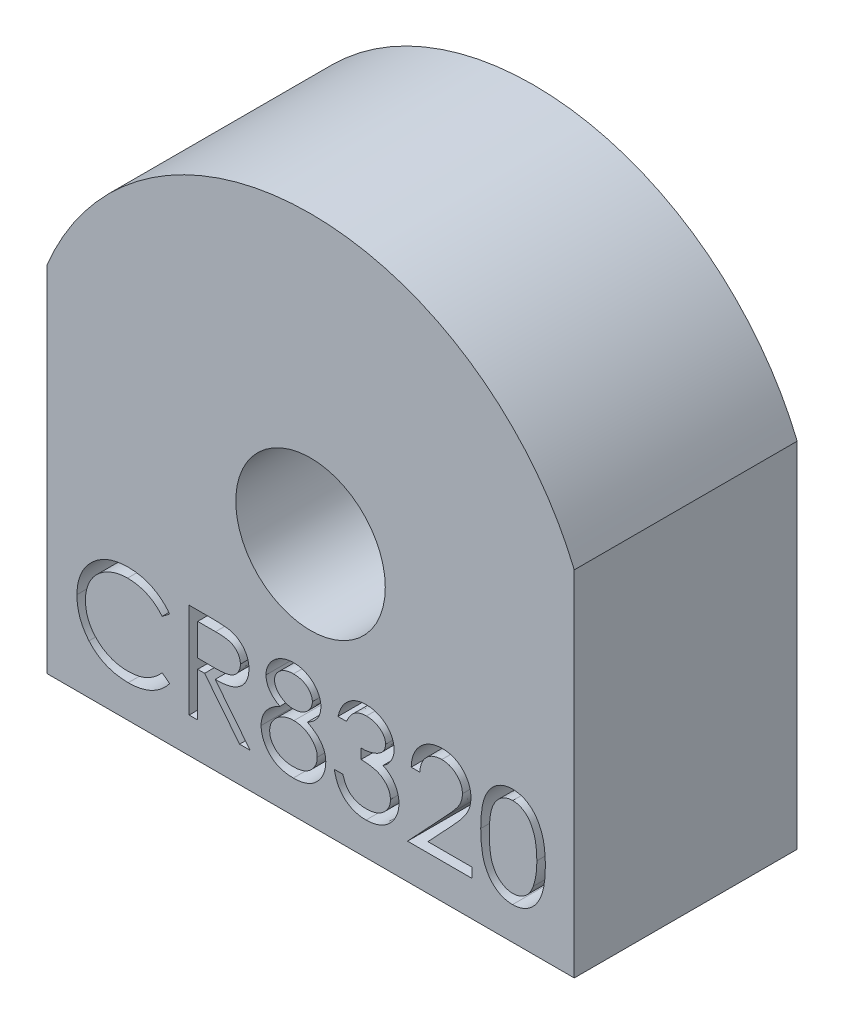
from build123d import *

# Parameters (mm, degrees)
BOSS_EXTRUDE2_DEPTH = 8.2
SKETCH3_R           = 2.75
CUT_EXTRUDE1_DEPTH  = 24.271871433
CUT_EXTRUDE2_DEPTH  = 3


with BuildPart() as part:
    # Sketch1 → Boss-Extrude2 (new body)
    with BuildSketch(Plane.XY):
        with BuildLine():
            Line((9.7, 13), (9.7, 0))
            Line((9.7, 0), (-9.7, 0))
            Line((-9.7, 0), (-9.7, 13))
            ThreePointArc((-9.7, 13), (0, 19.5), (9.7, 13))
        make_face()
    extrude(amount=BOSS_EXTRUDE2_DEPTH)

    # Sketch3 → Cut-Extrude1 (cut, through all)
    with BuildSketch(Plane.XY.offset(8.2)):
        with Locations((0, 8.968179787)):
            Circle(SKETCH3_R)
    extrude(amount=-CUT_EXTRUDE1_DEPTH, mode=Mode.SUBTRACT)

    # Sketch4 → Cut-Extrude2 (cut)
    # profile 1 of 6: a face of its own
    with BuildSketch(Plane.XY.offset(8.2)):
        with BuildLine():
            Line((-5.182729321, 4.150943221), (-5.457569065, 3.940606683))
            add(Edge.make_bspline(
                [(-5.457569065, 3.940606683), (-5.477174953, 3.963972653), (-5.5161224, 4.010389568), (-5.578781602, 4.075569113), (-5.644083245, 4.136634374), (-5.712002366, 4.193876254), (-5.783761486, 4.24529302), (-5.857622285, 4.293564123), (-5.93482033, 4.336831861), (-6.041572064, 4.389294847), (-6.181219913, 4.444041002), (-6.357014752, 4.489944233), (-6.54052585, 4.519165409), (-6.66572345, 4.52233025), (-6.729404, 4.523940016)],
                knots=[0, 0, 0, 0, 0.757959112, 1.505699292, 2.245454638, 2.979532153, 3.711538275, 4.438200793, 5.171680507, 5.909471876, 7.393775596, 8.890124382, 10.418191784, 12, 12, 12, 12], degree=3))
            add(Edge.make_bspline(
                [(-6.729404, 4.523940016), (-6.7644873, 4.523536054), (-6.834328292, 4.522731878), (-6.937976766, 4.512122753), (-7.039689817, 4.497211543), (-7.139401283, 4.475086219), (-7.236984242, 4.4471136), (-7.333076644, 4.413688186), (-7.426287244, 4.372333346), (-7.517905482, 4.326625087), (-7.605684693, 4.274997642), (-7.688739741, 4.21868429), (-7.766767709, 4.158315193), (-7.839830321, 4.093664087), (-7.908002269, 4.025022127), (-7.97078958, 3.951657785), (-8.02797499, 3.873805612), (-8.080692015, 3.792492204), (-8.127904749, 3.707954412), (-8.167434628, 3.619879342), (-8.20243975, 3.529775239), (-8.230138993, 3.436624078), (-8.25206351, 3.341081312), (-8.267191173, 3.242890524), (-8.277679644, 3.142256845), (-8.278479821, 3.074047532), (-8.278883167, 3.039665176)],
                knots=[0, 0, 0, 0, 1.054917814, 2.100044995, 3.131103042, 4.146048494, 5.169673617, 6.183595914, 7.203665975, 8.234915748, 9.262203917, 10.264457458, 11.251630812, 12.227803204, 13.197192746, 14.159520551, 15.12972552, 16.100847026, 17.073214652, 18.039054194, 19.002613845, 19.979014051, 20.95965708, 21.949030935, 22.966165397, 24, 24, 24, 24], degree=3))
            add(Edge.make_bspline(
                [(-8.278883167, 3.039665176), (-8.277621348, 2.987933857), (-8.275143934, 2.886366272), (-8.2530956, 2.737595661), (-8.219590508, 2.595074987), (-8.169374932, 2.459695145), (-8.107455881, 2.329786787), (-8.029215269, 2.207547934), (-7.938598732, 2.091131369), (-7.834324313, 1.983288421), (-7.719918497, 1.884774696), (-7.597170585, 1.798024115), (-7.466386297, 1.725709232), (-7.329009667, 1.665533286), (-7.183983553, 1.619276558), (-7.031568751, 1.586712434), (-6.872096756, 1.565470254), (-6.763127356, 1.563436566), (-6.707669225, 1.562401555)],
                knots=[0, 0, 0, 0, 1.029171465, 2.020641659, 2.987623507, 3.938342917, 4.889210282, 5.84687017, 6.821220943, 7.821438502, 8.827599549, 9.822697543, 10.807740252, 11.797342354, 12.80366471, 13.83203677, 14.896651826, 16, 16, 16, 16], degree=3))
            add(Edge.make_bspline(
                [(-6.707669225, 1.562401555), (-6.646566536, 1.564090334), (-6.526301827, 1.567414257), (-6.349933801, 1.595573506), (-6.181098035, 1.641231424), (-6.019785448, 1.705129346), (-5.866450802, 1.788194634), (-5.720854142, 1.888892512), (-5.582872571, 2.008180844), (-5.499901289, 2.099263973), (-5.457569065, 2.145734888)],
                knots=[0, 0, 0, 0, 1.028121516, 2.023589091, 2.998037872, 3.967518031, 4.937445131, 5.927275754, 6.942489185, 8, 8, 8, 8], degree=3))
            Line((-5.457569065, 2.145734888), (-5.182729321, 1.937501715))
            add(Edge.make_bspline(
                [(-5.182729321, 1.937501715), (-5.204847431, 1.908963263), (-5.248977706, 1.852023057), (-5.320435723, 1.771751347), (-5.395713021, 1.696247311), (-5.475368731, 1.62611969), (-5.558486522, 1.559965225), (-5.646558834, 1.499663393), (-5.738427867, 1.444372509), (-5.833782346, 1.393745585), (-5.932520959, 1.348828338), (-6.034525394, 1.31037457), (-6.139355969, 1.27724968), (-6.247017478, 1.249997744), (-6.357733234, 1.22872666), (-6.471103708, 1.214506985), (-6.587373584, 1.20476507), (-6.665815005, 1.203877155), (-6.705565859, 1.203427196)],
                knots=[0, 0, 0, 0, 0.986787822, 1.968848986, 2.935600012, 3.899624008, 4.868462664, 5.837806735, 6.815139263, 7.798259679, 8.787526145, 9.778297419, 10.776456485, 11.791383307, 12.812564526, 13.85620153, 14.913611965, 16, 16, 16, 16], degree=3))
            add(Edge.make_bspline(
                [(-6.705565859, 1.203427196), (-6.743209527, 1.203689188), (-6.817645217, 1.204207246), (-6.927543968, 1.212599413), (-7.034533549, 1.22404915), (-7.138308175, 1.241289281), (-7.23943415, 1.261633622), (-7.336994734, 1.288904878), (-7.431949945, 1.319454045), (-7.523918285, 1.355359031), (-7.612977985, 1.395875214), (-7.698841797, 1.441666773), (-7.781470229, 1.492348638), (-7.86167565, 1.546803648), (-7.938273234, 1.60678095), (-8.011926759, 1.671447584), (-8.083049235, 1.740585595), (-8.12705192, 1.790440448), (-8.149175635, 1.815506523)],
                knots=[0, 0, 0, 0, 1.114604814, 2.203992996, 3.262667896, 4.300477797, 5.318619304, 6.316056647, 7.298880507, 8.271930387, 9.238335007, 10.195173496, 11.151986948, 12.108099108, 13.064862484, 14.031167946, 15.010108607, 16, 16, 16, 16], degree=3))
            add(Edge.make_bspline(
                [(-8.149175635, 1.815506523), (-8.184611279, 1.859047712), (-8.255054755, 1.945604422), (-8.345180439, 2.085890403), (-8.422327994, 2.232358612), (-8.484703915, 2.385778541), (-8.533466648, 2.545805928), (-8.567247843, 2.712521442), (-8.589199448, 2.885769385), (-8.591709736, 3.003606173), (-8.592985731, 3.063503317)],
                knots=[0, 0, 0, 0, 0.994628077, 1.977248131, 2.950237994, 3.925870899, 4.908910175, 5.911660606, 6.938484602, 8, 8, 8, 8], degree=3))
            add(Edge.make_bspline(
                [(-8.592985731, 3.063503317), (-8.591430538, 3.126458771), (-8.588370791, 3.250319696), (-8.562374996, 3.432093649), (-8.5205562, 3.606245048), (-8.461159311, 3.772448792), (-8.38585396, 3.931579073), (-8.292827346, 4.082420277), (-8.183160204, 4.225937077), (-8.057712636, 4.359951828), (-7.920145301, 4.482491181), (-7.772826487, 4.590297385), (-7.61604454, 4.680014901), (-7.451526688, 4.755011063), (-7.278041007, 4.812655526), (-7.095957638, 4.853008713), (-6.905618723, 4.878125829), (-6.775756297, 4.881301037), (-6.70977259, 4.882914375)],
                knots=[0, 0, 0, 0, 1.032925535, 2.032216505, 3.007276963, 3.968222605, 4.92396291, 5.891752235, 6.871517503, 7.883894988, 8.900124299, 9.891468569, 10.874487609, 11.85992873, 12.854644235, 13.869047385, 14.917252991, 16, 16, 16, 16], degree=3))
            add(Edge.make_bspline(
                [(-6.70977259, 4.882914375), (-6.669558118, 4.882432237), (-6.589957621, 4.881477893), (-6.472204969, 4.872171751), (-6.357562642, 4.856658145), (-6.24595166, 4.835542075), (-6.136829043, 4.809334753), (-6.031028803, 4.775194455), (-5.927930116, 4.736157924), (-5.828183207, 4.691199458), (-5.732266657, 4.640732716), (-5.640210339, 4.585317093), (-5.55274548, 4.525021287), (-5.469256632, 4.460358112), (-5.391140421, 4.389959553), (-5.316178942, 4.315761957), (-5.246917864, 4.235628132), (-5.204164669, 4.179223199), (-5.182729321, 4.150943221)],
                knots=[0, 0, 0, 0, 1.096760587, 2.17092713, 3.219439832, 4.250915756, 5.268269357, 6.278326846, 7.281116186, 8.274029601, 9.260640565, 10.235837813, 11.203064059, 12.156899882, 13.114053108, 14.069676657, 15.032185724, 16, 16, 16, 16], degree=3))
        make_face()
    # profile 2 of 6: a face of its own
    with BuildSketch(Plane.XY.offset(8.2)):
        with BuildLine():
            Line((-4.464780603, 4.793170785), (-3.76435993, 4.793170785))
            add(Edge.make_bspline(
                [(-3.76435993, 4.793170785), (-3.717618801, 4.793015199), (-3.627870657, 4.792716457), (-3.499297387, 4.791050694), (-3.38247029, 4.786276338), (-3.27745045, 4.782167755), (-3.184239795, 4.774675814), (-3.102552505, 4.767515167), (-3.032764807, 4.758141506), (-2.990518956, 4.749436083), (-2.97139118, 4.745494503)],
                knots=[0, 0, 0, 0, 1.410062039, 2.707475311, 3.878576406, 4.937260626, 5.877586885, 6.699081471, 7.410979367, 8, 8, 8, 8], degree=3))
            add(Edge.make_bspline(
                [(-2.97139118, 4.745494503), (-2.945784556, 4.739167738), (-2.895117566, 4.726649174), (-2.8221675, 4.700189574), (-2.752653176, 4.669569949), (-2.686863352, 4.633606229), (-2.625127561, 4.592031449), (-2.56680925, 4.545563326), (-2.511643787, 4.494456121), (-2.461862157, 4.437421279), (-2.414923105, 4.37758477), (-2.375334478, 4.312881013), (-2.341207999, 4.245219485), (-2.314037482, 4.173912067), (-2.292159508, 4.099650296), (-2.276733269, 4.021761499), (-2.267482081, 3.940600524), (-2.266540226, 3.885242615), (-2.266062654, 3.857173189)],
                knots=[0, 0, 0, 0, 1.027469482, 2.033020251, 3.019912614, 3.986113645, 4.951240523, 5.91722682, 6.890402269, 7.87763091, 8.8651537, 9.85103654, 10.82876324, 11.815024772, 12.821070561, 13.842952187, 14.906261191, 16, 16, 16, 16], degree=3))
            add(Edge.make_bspline(
                [(-2.266062654, 3.857173189), (-2.267531652, 3.810538085), (-2.270398048, 3.719540917), (-2.297123152, 3.587480035), (-2.340899672, 3.464290721), (-2.401222961, 3.350128083), (-2.478042436, 3.247217437), (-2.570367227, 3.156826982), (-2.678248839, 3.08118707), (-2.778678155, 3.028734265), (-2.867392355, 2.995141356), (-2.940425667, 2.971504997), (-3.020092645, 2.953243032), (-3.105629979, 2.9368829), (-3.197393635, 2.924531206), (-3.295163674, 2.915484611), (-3.399009826, 2.909830563), (-3.470348895, 2.908988558), (-3.507048231, 2.908555401)],
                knots=[0, 0, 0, 0, 1.260483769, 2.459530307, 3.627416485, 4.787058657, 5.939039949, 7.08810263, 8.267026773, 9.491475466, 10.141966685, 10.831826277, 11.566392101, 12.351337768, 13.187381173, 14.07005841, 15.007169909, 16, 16, 16, 16], degree=3))
            Line((-3.507048231, 2.908555401), (-2.221190859, 1.293170785))
            Line((-2.221190859, 1.293170785), (-2.609612334, 1.293170785))
            Line((-2.609612334, 1.293170785), (-3.895469706, 2.908555401))
            Line((-3.895469706, 2.908555401), (-4.150678039, 2.908555401))
            Line((-4.150678039, 2.908555401), (-4.150678039, 1.293170785))
            Line((-4.150678039, 1.293170785), (-4.464780603, 1.293170785))
            Line((-4.464780603, 1.293170785), (-4.464780603, 4.793170785))
        make_face()
        with BuildLine():
            Line((-4.150678039, 4.434196426), (-4.150678039, 3.26752976))
            Line((-4.150678039, 3.26752976), (-3.509852718, 3.262621907))
            add(Edge.make_bspline(
                [(-3.509852718, 3.262621907), (-3.47993268, 3.262608671), (-3.421939122, 3.262583014), (-3.338038458, 3.26657679), (-3.259918346, 3.271120109), (-3.187877594, 3.278069454), (-3.121884018, 3.287025526), (-3.061970605, 3.29822851), (-3.008039553, 3.311280573), (-2.945141015, 3.331482199), (-2.874904484, 3.363488217), (-2.798573024, 3.410053716), (-2.733570686, 3.468622835), (-2.678652824, 3.535596291), (-2.634523392, 3.60923254), (-2.603411338, 3.688648909), (-2.583668895, 3.771840507), (-2.58134035, 3.829018615), (-2.580165218, 3.857874311)],
                knots=[0, 0, 0, 0, 1.146690395, 2.22261258, 3.21895312, 4.145990853, 4.996080663, 5.770904154, 6.481378293, 7.121626537, 8.300444488, 9.431385265, 10.535395872, 11.636531494, 12.74115979, 13.810798291, 14.895190096, 16, 16, 16, 16], degree=3))
            add(Edge.make_bspline(
                [(-2.580165218, 3.857874311), (-2.58136734, 3.886020885), (-2.583749505, 3.941797123), (-2.603198273, 4.023453034), (-2.636087655, 4.100519984), (-2.680409893, 4.172684469), (-2.734409048, 4.238190205), (-2.79772686, 4.294237358), (-2.868632055, 4.340486822), (-2.934903254, 4.370041203), (-2.994137466, 4.388161056), (-3.045567126, 4.40091222), (-3.103678604, 4.411156689), (-3.168754063, 4.41936475), (-3.240515693, 4.426419694), (-3.319326345, 4.431171473), (-3.404663125, 4.433985337), (-3.463810056, 4.434124426), (-3.494428039, 4.434196426)],
                knots=[0, 0, 0, 0, 1.101028733, 2.181837193, 3.264309656, 4.369019818, 5.486613113, 6.575447106, 7.666700264, 8.788928104, 9.402425223, 10.0903467, 10.862060571, 11.710948788, 12.657782767, 13.684531032, 14.801375019, 16, 16, 16, 16], degree=3))
            Line((-3.494428039, 4.434196426), (-4.150678039, 4.434196426))
        make_face(mode=Mode.SUBTRACT)
    # profile 3 of 6: a face of its own
    with BuildSketch(Plane.XY.offset(8.2)):
        with BuildLine():
            add(Edge.make_bspline(
                [(-0.115722109, 3.242990497), (-0.087073562, 3.228052541), (-0.031199328, 3.198918538), (0.048377881, 3.15200771), (0.121102882, 3.102566746), (0.188993444, 3.052930886), (0.250856794, 3.001199235), (0.306001207, 2.947166079), (0.355788827, 2.892180133), (0.399215611, 2.835310293), (0.437412448, 2.776707644), (0.470424583, 2.716218371), (0.498641786, 2.653975037), (0.521004725, 2.589298207), (0.539426516, 2.523137946), (0.552102121, 2.454639964), (0.558919039, 2.384255623), (0.560207853, 2.336687321), (0.560860423, 2.312601875)],
                knots=[0, 0, 0, 0, 1.272397273, 2.481599622, 3.635517121, 4.734568067, 5.792894095, 6.808321871, 7.773003508, 8.711915296, 9.623354172, 10.525449501, 11.423591555, 12.311487226, 13.218079475, 14.126165749, 15.051214107, 16, 16, 16, 16], degree=3))
            add(Edge.make_bspline(
                [(0.560860423, 2.312601875), (0.560089002, 2.278904143), (0.558562071, 2.212203686), (0.545262087, 2.113757574), (0.525349109, 2.018145792), (0.496269597, 1.925389302), (0.458556206, 1.835999928), (0.41207937, 1.749901155), (0.359468165, 1.665681846), (0.317215925, 1.613862444), (0.295836384, 1.587641939)],
                knots=[0, 0, 0, 0, 1.025265484, 2.029385089, 3.018602448, 3.995076438, 4.983346944, 5.966715145, 6.97116228, 8, 8, 8, 8], degree=3))
            add(Edge.make_bspline(
                [(0.295836384, 1.587641939), (0.26799991, 1.557048165), (0.212670944, 1.496238672), (0.117888017, 1.417287862), (0.013866133, 1.350938468), (-0.0989922, 1.296866574), (-0.220385301, 1.254780715), (-0.350287306, 1.224538197), (-0.488951459, 1.207215768), (-0.58425693, 1.204711778), (-0.633149994, 1.203427196)],
                knots=[0, 0, 0, 0, 0.954267603, 1.896743057, 2.838368354, 3.796610408, 4.779680527, 5.799409237, 6.871065594, 8, 8, 8, 8], degree=3))
            add(Edge.make_bspline(
                [(-0.633149994, 1.203427196), (-0.680163383, 1.204579674), (-0.771646662, 1.206822279), (-0.904804539, 1.22201671), (-1.028927609, 1.248644577), (-1.144737577, 1.285089186), (-1.251536271, 1.332499415), (-1.349019372, 1.391507823), (-1.438593344, 1.459739265), (-1.517539818, 1.539153344), (-1.587628262, 1.624211216), (-1.649196315, 1.711962826), (-1.700370393, 1.802416183), (-1.743697488, 1.89422255), (-1.776865511, 1.988668705), (-1.799837722, 2.085268718), (-1.814427036, 2.183853861), (-1.81636817, 2.250385514), (-1.817344706, 2.283855882)],
                knots=[0, 0, 0, 0, 1.256902934, 2.445805442, 3.576955095, 4.645999104, 5.686449165, 6.692658513, 7.68621702, 8.689161843, 9.678783111, 10.630372946, 11.551080876, 12.453998257, 13.34127905, 14.221779781, 15.105423033, 16, 16, 16, 16], degree=3))
            add(Edge.make_bspline(
                [(-1.817344706, 2.283855882), (-1.816766825, 2.308415074), (-1.815624728, 2.356952705), (-1.807719879, 2.428662034), (-1.795011418, 2.498458169), (-1.777751961, 2.566598912), (-1.754360935, 2.632588185), (-1.726118802, 2.696738658), (-1.693186849, 2.759122757), (-1.655105684, 2.820081638), (-1.61080366, 2.878761151), (-1.56064001, 2.936157145), (-1.503612142, 2.991379012), (-1.440354483, 3.045101437), (-1.371589943, 3.098277411), (-1.295532413, 3.14803314), (-1.214198145, 3.197891105), (-1.15639274, 3.22769943), (-1.126739738, 3.242990497)],
                knots=[0, 0, 0, 0, 0.941657376, 1.861047343, 2.762797495, 3.66048619, 4.553285746, 5.444104102, 6.34607688, 7.256116206, 8.197091036, 9.162375105, 10.176350973, 11.237807142, 12.343728897, 13.50695164, 14.721116704, 16, 16, 16, 16], degree=3))
            add(Edge.make_bspline(
                [(-1.126739738, 3.242990497), (-1.167331112, 3.265125266), (-1.245927375, 3.307984373), (-1.349996816, 3.386731179), (-1.43938744, 3.472018994), (-1.511642157, 3.565648789), (-1.568514385, 3.664695663), (-1.60753299, 3.768539916), (-1.633929474, 3.875256029), (-1.636544301, 3.948162226), (-1.637857526, 3.984777356)],
                knots=[0, 0, 0, 0, 1.166880483, 2.259407225, 3.286803203, 4.280235371, 5.237608625, 6.161067461, 7.076446754, 8, 8, 8, 8], degree=3))
            add(Edge.make_bspline(
                [(-1.637857526, 3.984777356), (-1.636222102, 4.022074914), (-1.632934614, 4.097049511), (-1.606351294, 4.208655635), (-1.563031227, 4.3182722), (-1.50411023, 4.425367912), (-1.430723014, 4.526318127), (-1.342676468, 4.616859073), (-1.242073171, 4.696170556), (-1.129415304, 4.762746729), (-1.008179069, 4.816930387), (-0.880263345, 4.85430881), (-0.747896852, 4.878744927), (-0.657799132, 4.881511582), (-0.61211634, 4.882914375)],
                knots=[0, 0, 0, 0, 0.888701115, 1.786444228, 2.72001202, 3.692817113, 4.693886446, 5.687152267, 6.695133018, 7.739871481, 8.800368666, 9.853104506, 10.91144658, 12, 12, 12, 12], degree=3))
            add(Edge.make_bspline(
                [(-0.61211634, 4.882914375), (-0.567612525, 4.881468032), (-0.479856072, 4.878616008), (-0.350861445, 4.85482913), (-0.227436567, 4.81509961), (-0.110007068, 4.761202387), (-0.000675201, 4.694815446), (0.095927109, 4.614414572), (0.181259691, 4.524273021), (0.251844085, 4.423353418), (0.310006974, 4.316669225), (0.350507875, 4.205046704), (0.376459849, 4.090897645), (0.379733213, 4.013659641), (0.381373243, 3.974961651)],
                knots=[0, 0, 0, 0, 1.072916533, 2.115669174, 3.151510826, 4.193348718, 5.225979165, 6.227137561, 7.216255879, 8.211077061, 9.189680878, 10.138522389, 11.067357538, 12, 12, 12, 12], degree=3))
            add(Edge.make_bspline(
                [(0.381373243, 3.974961651), (0.379938682, 3.936984987), (0.377121287, 3.862400978), (0.353421347, 3.753674457), (0.313508034, 3.651852418), (0.259013871, 3.555779466), (0.187988383, 3.467197968), (0.10137965, 3.384981499), (-0.000121828, 3.30845467), (-0.076382714, 3.265268306), (-0.115722109, 3.242990497)],
                knots=[0, 0, 0, 0, 0.975232327, 1.915300861, 2.843280834, 3.77672583, 4.742871857, 5.749627742, 6.839139064, 8, 8, 8, 8], degree=3))
        make_face()
        with BuildLine():
            add(Edge.make_bspline(
                [(-0.629644385, 4.523940016), (-0.654195191, 4.523288576), (-0.702227302, 4.522014073), (-0.772655973, 4.515355436), (-0.839628341, 4.502402219), (-0.903844141, 4.485163508), (-0.964422953, 4.46187552), (-1.022187508, 4.43448051), (-1.076154698, 4.401174445), (-1.126976001, 4.363813247), (-1.172726775, 4.322720341), (-1.213331327, 4.279906622), (-1.247059441, 4.23453123), (-1.275700551, 4.18772287), (-1.296482068, 4.138092294), (-1.312046372, 4.087161118), (-1.322567763, 4.034285734), (-1.323356154, 3.998149223), (-1.323754962, 3.979869503)],
                knots=[0, 0, 0, 0, 1.203892937, 2.355340988, 3.463153438, 4.544400666, 5.610487187, 6.640501085, 7.674077295, 8.714426146, 9.728707835, 10.68524104, 11.601827946, 12.495867327, 13.368432065, 14.231010473, 15.105153427, 16, 16, 16, 16], degree=3))
            add(Edge.make_bspline(
                [(-1.323754962, 3.979869503), (-1.323067595, 3.961588994), (-1.321709259, 3.925464081), (-1.311204131, 3.872118215), (-1.295547277, 3.819696578), (-1.270896615, 3.769445667), (-1.241330257, 3.719622308), (-1.204838781, 3.671471722), (-1.161349753, 3.624826337), (-1.112322313, 3.580082896), (-1.058910775, 3.538184133), (-1.002326731, 3.501810951), (-0.94328034, 3.471376841), (-0.882378271, 3.446047436), (-0.818999824, 3.426357499), (-0.75353335, 3.412388852), (-0.685967848, 3.403706855), (-0.640187267, 3.402669834), (-0.617024193, 3.402145144)],
                knots=[0, 0, 0, 0, 0.873023192, 1.725219244, 2.590779336, 3.480155217, 4.391973325, 5.357036234, 6.360879153, 7.436073238, 8.526419356, 9.601555421, 10.645666583, 11.697338044, 12.750135903, 13.812665442, 14.89329948, 16, 16, 16, 16], degree=3))
            add(Edge.make_bspline(
                [(-0.617024193, 3.402145144), (-0.587274089, 3.403018012), (-0.528067721, 3.404755125), (-0.44078839, 3.420906298), (-0.355925745, 3.446312216), (-0.274386841, 3.481072182), (-0.198282256, 3.524700042), (-0.130442187, 3.57693306), (-0.071445295, 3.636565157), (-0.021904684, 3.702667993), (0.016505162, 3.773019581), (0.04640697, 3.843619874), (0.063868185, 3.915222105), (0.066145752, 3.963189069), (0.067270679, 3.986880721)],
                knots=[0, 0, 0, 0, 1.076279235, 2.141928126, 3.20205304, 4.278698113, 5.344010996, 6.36967002, 7.368914609, 8.37248503, 9.349703398, 10.264243087, 11.142681841, 12, 12, 12, 12], degree=3))
            add(Edge.make_bspline(
                [(0.067270679, 3.986880721), (0.066738781, 4.003508757), (0.065683041, 4.036513025), (0.056982985, 4.085251391), (0.042607152, 4.132880974), (0.023144072, 4.179795245), (-0.002465723, 4.225335977), (-0.03282991, 4.270219065), (-0.069714412, 4.313434829), (-0.111110845, 4.355990377), (-0.158056254, 4.395374401), (-0.210460166, 4.430009111), (-0.268053916, 4.459421468), (-0.330838866, 4.483310222), (-0.39858379, 4.501252572), (-0.470976665, 4.51468892), (-0.548621112, 4.522262031), (-0.602050863, 4.523368557), (-0.629644385, 4.523940016)],
                knots=[0, 0, 0, 0, 0.814439003, 1.616544685, 2.417341072, 3.248991801, 4.09997495, 4.973547432, 5.9003056, 6.880240646, 7.880314356, 8.896779544, 9.951930927, 11.043077905, 12.18215768, 13.381699519, 14.647792085, 16, 16, 16, 16], degree=3))
        make_face(mode=Mode.SUBTRACT)
        with BuildLine():
            add(Edge.make_bspline(
                [(-0.609311853, 3.043170785), (-0.640437639, 3.042617144), (-0.701498835, 3.041531035), (-0.790955763, 3.029441534), (-0.876808929, 3.012612141), (-0.958768865, 2.987081303), (-1.036800962, 2.953884813), (-1.111327645, 2.913950273), (-1.181778774, 2.866744829), (-1.2471815, 2.812868214), (-1.30690483, 2.75480876), (-1.35930313, 2.693346625), (-1.40380065, 2.629624092), (-1.439633901, 2.562831863), (-1.469045633, 2.494384252), (-1.488359511, 2.422576657), (-1.500741222, 2.348789543), (-1.502403854, 2.298629445), (-1.503242142, 2.273339055)],
                knots=[0, 0, 0, 0, 1.140299081, 2.23698856, 3.303958914, 4.344563908, 5.37730929, 6.408454204, 7.439741482, 8.480804886, 9.510774543, 10.48932336, 11.43758569, 12.353841022, 13.263987381, 14.161954604, 15.073269652, 16, 16, 16, 16], degree=3))
            add(Edge.make_bspline(
                [(-1.503242142, 2.273339055), (-1.501878883, 2.241908149), (-1.499174209, 2.179549965), (-1.47771757, 2.087386894), (-1.443282035, 1.998165839), (-1.395256819, 1.912613886), (-1.335789246, 1.83266378), (-1.262662778, 1.762975004), (-1.180421941, 1.701053526), (-1.086284087, 1.650972992), (-0.983455621, 1.610978137), (-0.871963892, 1.583422175), (-0.753408973, 1.565180725), (-0.671549381, 1.563342544), (-0.629644385, 1.562401555)],
                knots=[0, 0, 0, 0, 0.898778495, 1.783155532, 2.693654817, 3.627872908, 4.583023416, 5.533784346, 6.509005473, 7.520592997, 8.575161974, 9.658835044, 10.801527049, 12, 12, 12, 12], degree=3))
            add(Edge.make_bspline(
                [(-0.629644385, 1.562401555), (-0.596894017, 1.563030363), (-0.533085798, 1.564255484), (-0.439999849, 1.575069778), (-0.352155301, 1.592219402), (-0.269722502, 1.617162948), (-0.191778663, 1.647612925), (-0.119645308, 1.686785006), (-0.051466781, 1.731337329), (0.009397341, 1.784195486), (0.06483055, 1.840674981), (0.113163843, 1.900465024), (0.155121394, 1.961940656), (0.18805235, 2.026491141), (0.214378603, 2.092878055), (0.233302158, 2.161713567), (0.244978373, 2.2332088), (0.246159269, 2.281707871), (0.246757858, 2.306291779)],
                knots=[0, 0, 0, 0, 1.224942928, 2.386581632, 3.501229538, 4.569074225, 5.605009692, 6.626002462, 7.634866581, 8.645888296, 9.63523824, 10.59253846, 11.518950513, 12.414518923, 13.29783783, 14.186679152, 15.080837789, 16, 16, 16, 16], degree=3))
            add(Edge.make_bspline(
                [(0.246757858, 2.306291779), (0.24585201, 2.33016912), (0.244065835, 2.377251064), (0.232729144, 2.447017591), (0.212813266, 2.514420405), (0.18548587, 2.580270411), (0.149104907, 2.643233362), (0.106260037, 2.704949533), (0.054565918, 2.763705978), (-0.003846678, 2.819959074), (-0.067505639, 2.87197481), (-0.135172784, 2.917989249), (-0.206327246, 2.956741365), (-0.280818456, 2.988257861), (-0.358481012, 3.01304533), (-0.439257791, 3.030361326), (-0.523243366, 3.041260928), (-0.580298236, 3.042526974), (-0.609311853, 3.043170785)],
                knots=[0, 0, 0, 0, 0.917430815, 1.809013306, 2.70690318, 3.612392954, 4.541220862, 5.495268465, 6.494511384, 7.542276156, 8.608045339, 9.649016899, 10.681629292, 11.715607085, 12.752076957, 13.808767841, 14.885711793, 16, 16, 16, 16], degree=3))
        make_face(mode=Mode.SUBTRACT)
    # profile 4 of 6: a face of its own
    with BuildSketch(Plane.XY.offset(8.2)):
        with BuildLine():
            Line((1.323680935, 3.985478478), (1.009578371, 3.985478478))
            add(Edge.make_bspline(
                [(1.009578371, 3.985478478), (1.018087922, 4.020710962), (1.034723398, 4.089587586), (1.069420971, 4.187994847), (1.107220226, 4.281118368), (1.152609331, 4.367214442), (1.202118085, 4.448013345), (1.258840807, 4.521682469), (1.320160529, 4.590095435), (1.387985478, 4.650808672), (1.45911414, 4.705786401), (1.53454876, 4.752661459), (1.612771653, 4.792985612), (1.694324786, 4.826205844), (1.779450958, 4.851231367), (1.867380581, 4.869388173), (1.958344082, 4.881179287), (2.020091672, 4.88233005), (2.051445358, 4.882914375)],
                knots=[0, 0, 0, 0, 1.162005537, 2.271625781, 3.343758855, 4.383309926, 5.390229558, 6.379919256, 7.361854164, 8.333198761, 9.295911338, 10.242430842, 11.177959212, 12.116337295, 13.062827104, 14.020064771, 14.994644689, 16, 16, 16, 16], degree=3))
            add(Edge.make_bspline(
                [(2.051445358, 4.882914375), (2.097128101, 4.881535145), (2.187497112, 4.878806769), (2.320260158, 4.853892333), (2.448286978, 4.814467201), (2.570176225, 4.759993473), (2.683394658, 4.69280616), (2.784130845, 4.612841423), (2.871019356, 4.521642122), (2.943913733, 4.420909558), (3.000988732, 4.313254048), (3.043075106, 4.202453891), (3.068696787, 4.08877192), (3.072017344, 4.012014641), (3.073680935, 3.973559407)],
                knots=[0, 0, 0, 0, 1.083050992, 2.142477498, 3.193116406, 4.255571735, 5.30263384, 6.308962982, 7.297363603, 8.282367274, 9.249857812, 10.179914175, 11.08814088, 12, 12, 12, 12], degree=3))
            add(Edge.make_bspline(
                [(3.073680935, 3.973559407), (3.072517344, 3.936552613), (3.070240377, 3.864136058), (3.050906672, 3.758414561), (3.018370409, 3.658772961), (2.973300646, 3.564791799), (2.914959096, 3.477066959), (2.844286399, 3.395401068), (2.760783737, 3.31943191), (2.697504799, 3.275912437), (2.664926929, 3.253507324)],
                knots=[0, 0, 0, 0, 1.024540389, 2.004866551, 2.965041327, 3.920577974, 4.882998113, 5.874504559, 6.905732034, 8, 8, 8, 8], degree=3))
            add(Edge.make_bspline(
                [(2.664926929, 3.253507324), (2.702158684, 3.235529152), (2.775925558, 3.199909195), (2.876476087, 3.130053437), (2.967753963, 3.04939709), (3.018657682, 2.986454437), (3.04423382, 2.954829439)],
                knots=[0, 0, 0, 0, 1.015518401, 2.012035669, 3.001164323, 4, 4, 4, 4], degree=3))
            add(Edge.make_bspline(
                [(3.04423382, 2.954829439), (3.061075162, 2.931771688), (3.094482058, 2.886033771), (3.135717592, 2.812497345), (3.173126706, 2.738145856), (3.202276926, 2.66098645), (3.224850793, 2.581913436), (3.240986825, 2.50079104), (3.251010966, 2.417553018), (3.252446518, 2.361240538), (3.253168115, 2.332934407)],
                knots=[0, 0, 0, 0, 1.025084078, 2.033381695, 3.024893161, 4.013698104, 4.991890475, 5.976764909, 6.982997093, 8, 8, 8, 8], degree=3))
            add(Edge.make_bspline(
                [(3.253168115, 2.332934407), (3.251373601, 2.283924686), (3.247793019, 2.186135884), (3.215788945, 2.041661163), (3.166175704, 1.90043566), (3.095718768, 1.765360821), (3.00985126, 1.63898044), (2.907693935, 1.525904131), (2.790407527, 1.428705527), (2.659601878, 1.347495299), (2.51788475, 1.282577376), (2.366309158, 1.237519934), (2.207059104, 1.208173934), (2.097851806, 1.205027065), (2.042330775, 1.203427196)],
                knots=[0, 0, 0, 0, 0.955779014, 1.907060117, 2.875433937, 3.871313158, 4.872415639, 5.851225146, 6.836215519, 7.83643374, 8.849228613, 9.86973379, 10.916971861, 12, 12, 12, 12], degree=3))
            add(Edge.make_bspline(
                [(2.042330775, 1.203427196), (2.004911475, 1.204295409), (1.93128277, 1.206003763), (1.823039271, 1.217682364), (1.719717572, 1.23901237), (1.621177974, 1.267715675), (1.527332938, 1.304107417), (1.438468833, 1.349426115), (1.354038939, 1.402737617), (1.274839988, 1.464671205), (1.20088142, 1.533952545), (1.134128696, 1.611811555), (1.073468903, 1.696808959), (1.020526264, 1.789932015), (0.972889312, 1.889977272), (0.933708355, 1.99822577), (0.899222786, 2.113709792), (0.883189322, 2.194187533), (0.874962987, 2.235478478)],
                knots=[0, 0, 0, 0, 1.048658725, 2.063410685, 3.046034179, 4.001477787, 4.936774919, 5.862367409, 6.792675028, 7.730719943, 8.675894397, 9.627829632, 10.600096036, 11.597688215, 12.626045268, 13.701542398, 14.82072376, 16, 16, 16, 16], degree=3))
            Line((0.874962987, 2.235478478), (1.189065551, 2.235478478))
            add(Edge.make_bspline(
                [(1.189065551, 2.235478478), (1.197248842, 2.208529464), (1.213166055, 2.156111293), (1.240260353, 2.080670987), (1.271128625, 2.011512934), (1.304243184, 1.948129812), (1.33902163, 1.88989741), (1.377936555, 1.83835554), (1.4181057, 1.791240338), (1.448385053, 1.764695726), (1.463204173, 1.751704439)],
                knots=[0, 0, 0, 0, 1.198163088, 2.33053128, 3.407730985, 4.417276592, 5.372219308, 6.28897303, 7.162600585, 8, 8, 8, 8], degree=3))
            add(Edge.make_bspline(
                [(1.463204173, 1.751704439), (1.482800749, 1.736596105), (1.521933412, 1.706426074), (1.585701643, 1.667924445), (1.652766529, 1.63456342), (1.724581203, 1.609079724), (1.799595974, 1.587502063), (1.879023339, 1.573381544), (1.962162556, 1.563693373), (2.01893032, 1.562838441), (2.04793975, 1.562401555)],
                knots=[0, 0, 0, 0, 0.946170439, 1.889420265, 2.845303464, 3.807233317, 4.801018734, 5.828864929, 6.890507805, 8, 8, 8, 8], degree=3))
            add(Edge.make_bspline(
                [(2.04793975, 1.562401555), (2.080693252, 1.56301746), (2.144739899, 1.564221809), (2.238194758, 1.575297516), (2.327102206, 1.59142793), (2.410475132, 1.616340913), (2.489405639, 1.647121764), (2.562787289, 1.685770169), (2.631583395, 1.731114891), (2.6949128, 1.78265405), (2.751858308, 1.839075545), (2.801997821, 1.898088616), (2.844622483, 1.959444445), (2.879006061, 2.023482566), (2.906156611, 2.089937795), (2.924639812, 2.158996625), (2.937491327, 2.230093891), (2.938537939, 2.27842286), (2.939065551, 2.30278617)],
                knots=[0, 0, 0, 0, 1.217147791, 2.380027433, 3.494444702, 4.572153297, 5.609568379, 6.639424714, 7.649109417, 8.668170816, 9.669597737, 10.625200337, 11.543417969, 12.441394052, 13.322311151, 14.205496177, 15.095365482, 16, 16, 16, 16], degree=3))
            add(Edge.make_bspline(
                [(2.939065551, 2.30278617), (2.937535249, 2.335397509), (2.934482261, 2.400457917), (2.911173681, 2.496175491), (2.872834817, 2.588398904), (2.819162306, 2.675554694), (2.753826577, 2.756330595), (2.67746167, 2.828402078), (2.589433442, 2.887872169), (2.508413573, 2.928960825), (2.436648416, 2.956997901), (2.375233032, 2.975672865), (2.306476429, 2.991486521), (2.23121008, 3.006198792), (2.148866863, 3.01872014), (2.059536425, 3.029161956), (1.963200664, 3.037516997), (1.896509498, 3.041248092), (1.862142474, 3.043170785)],
                knots=[0, 0, 0, 0, 1.07054697, 2.135767047, 3.216561865, 4.33974944, 5.486079747, 6.621378074, 7.775625952, 8.963672916, 9.598146892, 10.304877434, 11.070270905, 11.915000392, 12.823868403, 13.805723172, 14.86925407, 16, 16, 16, 16], degree=3))
            Line((1.862142474, 3.043170785), (1.862142474, 3.402145144))
            add(Edge.make_bspline(
                [(1.862142474, 3.402145144), (1.90544364, 3.402879948), (1.990259986, 3.404319248), (2.114154291, 3.421727259), (2.232627603, 3.445807887), (2.343054345, 3.482693079), (2.443703058, 3.525533376), (2.53102266, 3.575385585), (2.603789808, 3.630800334), (2.661650879, 3.692632944), (2.705180108, 3.758947991), (2.737006905, 3.828064649), (2.755807232, 3.90058871), (2.758316898, 3.950083378), (2.759578371, 3.974961651)],
                knots=[0, 0, 0, 0, 1.321986639, 2.589447074, 3.816329219, 5.01088745, 6.139805852, 7.153945165, 8.075214402, 8.924034688, 9.728124013, 10.488707548, 11.240355623, 12, 12, 12, 12], degree=3))
            add(Edge.make_bspline(
                [(2.759578371, 3.974961651), (2.75916396, 3.993239396), (2.758339509, 4.029602103), (2.747942232, 4.082727172), (2.732318191, 4.134228118), (2.710838461, 4.183885928), (2.682088263, 4.231356202), (2.647682276, 4.277043651), (2.606714176, 4.32068743), (2.559768729, 4.361367749), (2.509356924, 4.400136986), (2.454107149, 4.433050623), (2.395685274, 4.461195686), (2.334026619, 4.484405188), (2.268931089, 4.501864476), (2.200704531, 4.514400317), (2.129216848, 4.522237972), (2.080445116, 4.523366388), (2.055652089, 4.523940016)],
                knots=[0, 0, 0, 0, 0.884392785, 1.759457502, 2.611959086, 3.489218968, 4.37281399, 5.2945488, 6.255912374, 7.266815255, 8.301784654, 9.332968512, 10.37626691, 11.440494194, 12.520033166, 13.637162961, 14.798855837, 16, 16, 16, 16], degree=3))
            add(Edge.make_bspline(
                [(2.055652089, 4.523940016), (2.015800421, 4.522548654), (1.937960845, 4.519831001), (1.825745928, 4.496027987), (1.721426594, 4.458049904), (1.641687927, 4.412716884), (1.582805353, 4.36796645), (1.540728415, 4.328884064), (1.499407905, 4.28545124), (1.461562228, 4.234992865), (1.423288251, 4.180926075), (1.38844369, 4.120502393), (1.354583997, 4.055297999), (1.334181448, 4.009202364), (1.323680935, 3.985478478)],
                knots=[0, 0, 0, 0, 1.472543308, 2.876219568, 4.221790263, 5.565193594, 6.249813518, 6.953379497, 7.687249741, 8.463570142, 9.283606569, 10.136032583, 11.040678096, 12, 12, 12, 12], degree=3))
        make_face()
    # profile 5 of 6: a face of its own
    with BuildSketch(Plane.XY.offset(8.2)):
        with BuildLine():
            Line((4.015988628, 3.716247709), (3.701886064, 3.716247709))
            add(Edge.make_bspline(
                [(3.701886064, 3.716247709), (3.703933217, 3.757918596), (3.707953771, 3.839759111), (3.72678206, 3.959083017), (3.753722937, 4.073137816), (3.791814391, 4.18100773), (3.839120669, 4.283646537), (3.895850696, 4.380646553), (3.963044547, 4.471637742), (4.039251281, 4.555776585), (4.12201992, 4.632964156), (4.211325859, 4.699619398), (4.305170887, 4.75593707), (4.403270286, 4.803018312), (4.506730849, 4.838358158), (4.614613707, 4.864579797), (4.727392843, 4.880356143), (4.804232865, 4.882051929), (4.843312346, 4.882914375)],
                knots=[0, 0, 0, 0, 1.10065271, 2.161652631, 3.183658789, 4.190468796, 5.17591951, 6.163126047, 7.15150782, 8.156236427, 9.156009102, 10.134482811, 11.092018607, 12.041330605, 13.001268258, 13.972401359, 14.968799086, 16, 16, 16, 16], degree=3))
            add(Edge.make_bspline(
                [(4.843312346, 4.882914375), (4.88169042, 4.882015919), (4.957101964, 4.880250484), (5.067163979, 4.865089455), (5.171941273, 4.841343863), (5.27122904, 4.808028447), (5.364235104, 4.763244019), (5.451658149, 4.709446481), (5.53453896, 4.647226649), (5.609145743, 4.573972836), (5.677653823, 4.495770451), (5.736756078, 4.412282548), (5.787369241, 4.326053262), (5.829556921, 4.23642506), (5.86061306, 4.142554032), (5.884191268, 4.045806829), (5.897518682, 3.945182018), (5.899564105, 3.877075463), (5.900604012, 3.842449632)],
                knots=[0, 0, 0, 0, 1.111607364, 2.184268762, 3.212621178, 4.221274766, 5.211760367, 6.196651075, 7.1921475, 8.207485113, 9.220403448, 10.201281604, 11.166441695, 12.114753415, 13.065576456, 14.026450734, 14.996634279, 16, 16, 16, 16], degree=3))
            add(Edge.make_bspline(
                [(5.900604012, 3.842449632), (5.898910749, 3.793701797), (5.895553938, 3.697061583), (5.866839562, 3.555046721), (5.82199305, 3.417453302), (5.767995694, 3.306715999), (5.71352325, 3.217482506), (5.664435742, 3.144013801), (5.606970931, 3.064908332), (5.540292433, 2.980430995), (5.465779561, 2.88992009), (5.382757397, 2.793430294), (5.290633915, 2.691958525), (5.225975415, 2.622652923), (5.192471, 2.586740497)],
                knots=[0, 0, 0, 0, 1.184426356, 2.348067706, 3.509069118, 4.696110526, 5.333549288, 6.050745305, 6.844228056, 7.710549037, 8.667450064, 9.695053472, 10.805634456, 12, 12, 12, 12], degree=3))
            Line((5.192471, 2.586740497), (4.316769878, 1.652145144))
            Line((4.316769878, 1.652145144), (5.945475807, 1.652145144))
            Line((5.945475807, 1.652145144), (5.945475807, 1.293170785))
            Line((5.945475807, 1.293170785), (3.567270679, 1.293170785))
            Line((3.567270679, 1.293170785), (4.924642474, 2.741688414))
            add(Edge.make_bspline(
                [(4.924642474, 2.741688414), (4.957690361, 2.77618672), (5.021168588, 2.842450907), (5.110951165, 2.939193867), (5.191590153, 3.028943408), (5.263607546, 3.111529956), (5.325441051, 3.188161524), (5.380313283, 3.256356227), (5.424278874, 3.319110678), (5.47199427, 3.391851292), (5.518208251, 3.480663609), (5.557920607, 3.589197298), (5.582135456, 3.700924551), (5.585040291, 3.776426588), (5.586501448, 3.81440476)],
                knots=[0, 0, 0, 0, 1.329631726, 2.553950428, 3.673215718, 4.687767853, 5.603093632, 6.413772471, 7.123043292, 7.734684054, 8.834405432, 9.900288307, 10.943827018, 12, 12, 12, 12], degree=3))
            add(Edge.make_bspline(
                [(5.586501448, 3.81440476), (5.585865706, 3.838286158), (5.58461278, 3.885351809), (5.573555082, 3.954357568), (5.556844576, 4.020922381), (5.532899318, 4.085251001), (5.501292578, 4.146696653), (5.462819198, 4.205334133), (5.418429135, 4.262023098), (5.367077866, 4.315176396), (5.310666346, 4.363857602), (5.251072096, 4.406981687), (5.188021992, 4.443020798), (5.12178187, 4.472564295), (5.0525364, 4.495739676), (4.980151655, 4.511798256), (4.904827639, 4.521880739), (4.853394143, 4.523244911), (4.827186544, 4.523940016)],
                knots=[0, 0, 0, 0, 0.991446411, 1.95395049, 2.89581595, 3.838931463, 4.798493298, 5.75982156, 6.748411868, 7.785213223, 8.824556874, 9.840280684, 10.836137867, 11.835679398, 12.848801643, 13.863922112, 14.911575587, 16, 16, 16, 16], degree=3))
            add(Edge.make_bspline(
                [(4.827186544, 4.523940016), (4.799815712, 4.523224984), (4.746063915, 4.521820779), (4.667144882, 4.511998115), (4.591859105, 4.495052274), (4.520017202, 4.4718756), (4.451497616, 4.442417051), (4.386633572, 4.405725306), (4.325570683, 4.361941813), (4.26819416, 4.312301257), (4.21533018, 4.257033656), (4.168883305, 4.195423693), (4.12829929, 4.128596277), (4.092890057, 4.056731727), (4.064134367, 3.979177947), (4.042161216, 3.896210242), (4.02477437, 3.80818886), (4.018965849, 3.747403776), (4.015988628, 3.716247709)],
                knots=[0, 0, 0, 0, 1.031018746, 2.02475058, 2.990194455, 3.934040569, 4.864654155, 5.795059489, 6.735614925, 7.690564532, 8.649604399, 9.611025574, 10.590972636, 11.591080095, 12.624614302, 13.701020113, 14.821632451, 16, 16, 16, 16], degree=3))
        make_face()
    # profile 6 of 6: a face of its own
    with BuildSketch(Plane.XY.offset(8.2)):
        with BuildLine():
            add(Edge.make_bspline(
                [(6.259578371, 3.041768542), (6.259906389, 3.09786593), (6.260543569, 3.206835914), (6.26763199, 3.365620556), (6.279407333, 3.514580845), (6.295544706, 3.653723911), (6.315182686, 3.783085675), (6.341398172, 3.902320433), (6.371210975, 4.011980039), (6.405763421, 4.112422088), (6.44475121, 4.204999791), (6.487185471, 4.291424992), (6.534750265, 4.371566924), (6.584727178, 4.446704715), (6.63913925, 4.51560841), (6.69643804, 4.579251072), (6.758859916, 4.636161823), (6.824282925, 4.688008125), (6.893299389, 4.733457597), (6.963942055, 4.773490335), (7.036697161, 4.807690202), (7.111763344, 4.834580638), (7.188465902, 4.856791485), (7.267072968, 4.871980433), (7.347714332, 4.881537341), (7.402145767, 4.882451009), (7.429750647, 4.882914375)],
                knots=[0, 0, 0, 0, 1.646270934, 3.197905019, 4.663502075, 6.030701355, 7.308322542, 8.50163776, 9.611534131, 10.641858119, 11.616356847, 12.558055219, 13.465016945, 14.349605745, 15.204443733, 16.039544428, 16.859896111, 17.680448484, 18.487036065, 19.28249412, 20.06191084, 20.843045899, 21.620316918, 22.403196591, 23.190181807, 24, 24, 24, 24], degree=3))
            add(Edge.make_bspline(
                [(7.429750647, 4.882914375), (7.457586125, 4.88242656), (7.512942134, 4.881456449), (7.59478251, 4.872132507), (7.674732191, 4.856661383), (7.75245033, 4.834740409), (7.828575316, 4.807544732), (7.902511724, 4.773457615), (7.974718806, 4.733778748), (8.044049093, 4.68715487), (8.111263709, 4.635172594), (8.174711672, 4.576409925), (8.234398757, 4.511460206), (8.291074063, 4.441018342), (8.34312966, 4.363733257), (8.392703092, 4.280949148), (8.437075128, 4.191218283), (8.479809803, 4.096037815), (8.51669679, 3.992774156), (8.549963035, 3.882009396), (8.576842004, 3.762435209), (8.599231276, 3.634678964), (8.616576172, 3.49827148), (8.629208814, 3.353505165), (8.635881899, 3.200284774), (8.637138601, 3.095526925), (8.6377835, 3.041768542)],
                knots=[0, 0, 0, 0, 0.810914788, 1.612654377, 2.396697861, 3.181598691, 3.963628158, 4.749916497, 5.551656086, 6.361998678, 7.18212741, 8.025565596, 8.878627764, 9.750805457, 10.657531673, 11.591944965, 12.560506719, 13.57287815, 14.630710178, 15.753379473, 16.941251878, 18.199788006, 19.531962791, 20.947069417, 22.433333509, 24, 24, 24, 24], degree=3))
            add(Edge.make_bspline(
                [(8.6377835, 3.041768542), (8.637131915, 2.988244634), (8.635862329, 2.883955482), (8.629283622, 2.731424507), (8.616324991, 2.587426463), (8.600115003, 2.451616001), (8.57766404, 2.324558382), (8.550058874, 2.205813934), (8.519408551, 2.094869862), (8.481573757, 1.99263505), (8.440163046, 1.897683328), (8.39510785, 1.809016179), (8.346838024, 1.725849887), (8.294249279, 1.64885014), (8.238195866, 1.577471483), (8.177478077, 1.51297386), (8.113807492, 1.453803188), (8.046395076, 1.40115156), (7.975983525, 1.355066756), (7.904024448, 1.313852905), (7.829241065, 1.28062021), (7.753328112, 1.252085169), (7.675199746, 1.230284717), (7.594953355, 1.215210862), (7.512997119, 1.204639014), (7.457595554, 1.203832534), (7.429750647, 1.203427196)],
                knots=[0, 0, 0, 0, 1.561518951, 3.042555995, 4.452378317, 5.7783523, 7.031515105, 8.214008947, 9.334062868, 10.386615937, 11.391082383, 12.354592575, 13.286541444, 14.194233754, 15.072674879, 15.931287219, 16.775624067, 17.606195743, 18.42308326, 19.229000347, 20.022332153, 20.807536673, 21.593273796, 22.3848459, 23.188221202, 24, 24, 24, 24], degree=3))
            add(Edge.make_bspline(
                [(7.429750647, 1.203427196), (7.402146533, 1.203893551), (7.347716608, 1.204813113), (7.267064183, 1.214326845), (7.188781739, 1.229622348), (7.112482985, 1.251038952), (7.03777647, 1.277253788), (6.965680184, 1.311407472), (6.8953925, 1.350741541), (6.827100944, 1.395536962), (6.762088783, 1.446858645), (6.699990177, 1.503622934), (6.642365158, 1.567246345), (6.588731063, 1.636724268), (6.537756975, 1.711417511), (6.490867601, 1.792345884), (6.447496747, 1.879188494), (6.407853257, 1.972506405), (6.372704593, 2.073661333), (6.341656885, 2.183810511), (6.317142727, 2.303926147), (6.296159772, 2.433043515), (6.279235389, 2.571717445), (6.267681064, 2.720023223), (6.260539749, 2.877868432), (6.259904678, 2.986138206), (6.259578371, 3.041768542)],
                knots=[0, 0, 0, 0, 0.810891512, 1.598919785, 2.382837074, 3.152667961, 3.926044502, 4.706494248, 5.493654104, 6.291793342, 7.103789334, 7.925228297, 8.761435821, 9.622817696, 10.50288917, 11.416980706, 12.369136599, 13.353924996, 14.394355917, 15.514179734, 16.714354668, 17.994756427, 19.357759367, 20.818452758, 22.365282078, 24, 24, 24, 24], degree=3))
        make_face()
        with BuildLine():
            add(Edge.make_bspline(
                [(6.573680935, 3.043170785), (6.573800382, 2.996422087), (6.574032206, 2.905692042), (6.580088406, 2.773848781), (6.588338638, 2.650878452), (6.598979936, 2.536624916), (6.614782884, 2.431474903), (6.632489672, 2.33470522), (6.654037762, 2.246827983), (6.679532779, 2.167240172), (6.708571876, 2.094591104), (6.74027774, 2.026989889), (6.774338463, 1.963637952), (6.812457613, 1.905104344), (6.853972677, 1.85119818), (6.897945936, 1.800965347), (6.94601852, 1.756168366), (7.012522263, 1.702441511), (7.100318737, 1.646922377), (7.210939192, 1.598576287), (7.324607643, 1.568193831), (7.401758893, 1.564330075), (7.440267474, 1.562401555)],
                knots=[0, 0, 0, 0, 1.459021318, 2.831673884, 4.118529203, 5.306027144, 6.411944654, 7.436330062, 8.375795394, 9.233974572, 10.042671642, 10.816086306, 11.563610507, 12.285937304, 12.993564865, 13.685989202, 14.367179055, 15.041617293, 16.353048772, 17.594441528, 18.799311195, 20, 20, 20, 20], degree=3))
            add(Edge.make_bspline(
                [(7.440267474, 1.562401555), (7.479025146, 1.563999335), (7.556460469, 1.567191598), (7.669594264, 1.597990336), (7.779424534, 1.644459875), (7.865496474, 1.699407381), (7.930979018, 1.75173571), (7.977896008, 1.796350358), (8.020958056, 1.846306226), (8.061800131, 1.900205522), (8.099259207, 1.959078006), (8.133322344, 2.022640581), (8.164405692, 2.091069759), (8.182114738, 2.138839498), (8.191168916, 2.163262933)],
                knots=[0, 0, 0, 0, 1.353760809, 2.704726607, 4.075137775, 5.516104923, 6.260822281, 7.007110065, 7.778089737, 8.566572457, 9.372053459, 10.217411131, 11.088608312, 12, 12, 12, 12], degree=3))
            add(Edge.make_bspline(
                [(8.191168916, 2.163262933), (8.201720684, 2.194492672), (8.223145298, 2.257902437), (8.250757072, 2.356266089), (8.272502471, 2.459468853), (8.292065837, 2.566893969), (8.305418893, 2.67933367), (8.316166706, 2.796440054), (8.322497393, 2.918301416), (8.323282144, 3.001096408), (8.323680935, 3.043170785)],
                knots=[0, 0, 0, 0, 0.884706709, 1.796334032, 2.740027952, 3.714592787, 4.726048262, 5.777819803, 6.87074269, 8, 8, 8, 8], degree=3))
            add(Edge.make_bspline(
                [(8.323680935, 3.043170785), (8.323130746, 3.085238358), (8.322054458, 3.167531523), (8.317940471, 3.288049703), (8.307316896, 3.402517464), (8.295517777, 3.511427937), (8.278120556, 3.61417824), (8.259362749, 3.711628545), (8.234161537, 3.80257157), (8.207241762, 3.888431151), (8.176431367, 3.968231806), (8.142515632, 4.042345592), (8.106293874, 4.111130317), (8.066951633, 4.174397259), (8.02495595, 4.232429802), (7.979198401, 4.284064396), (7.931494028, 4.330901364), (7.864676842, 4.384363933), (7.777202552, 4.438875629), (7.668356905, 4.489041389), (7.555086261, 4.517849681), (7.478512807, 4.521911368), (7.440267474, 4.523940016)],
                knots=[0, 0, 0, 0, 1.31362396, 2.569729283, 3.763502607, 4.902122613, 5.988968491, 7.01645872, 7.998833611, 8.933434873, 9.825090667, 10.667526885, 11.477055099, 12.250526234, 12.991942729, 13.710640831, 14.402115721, 15.076753259, 16.378508321, 17.609869233, 18.806226677, 20, 20, 20, 20], degree=3))
            add(Edge.make_bspline(
                [(7.440267474, 4.523940016), (7.401556882, 4.52190857), (7.324065176, 4.517841975), (7.209617221, 4.489148722), (7.09991287, 4.439135756), (7.012669895, 4.384183383), (6.945806109, 4.331845072), (6.898723415, 4.286458618), (6.854577243, 4.236812364), (6.813909543, 4.182410449), (6.77582026, 4.123945081), (6.740839247, 4.060956317), (6.709321917, 3.993124952), (6.680237381, 3.920508517), (6.654664593, 3.840927573), (6.63357063, 3.753158579), (6.614083577, 3.656696687), (6.600288308, 3.550977179), (6.588024552, 3.436695026), (6.580143204, 3.313417708), (6.574011947, 3.181353327), (6.573793482, 3.090154169), (6.573680935, 3.043170785)],
                knots=[0, 0, 0, 0, 1.207732386, 2.417664972, 3.655092373, 4.956220595, 5.625982001, 6.301752483, 6.994047911, 7.697131622, 8.419323945, 9.170223765, 9.943494443, 10.752040957, 11.610060368, 12.549350801, 13.567764191, 14.679664412, 15.874934091, 17.154273443, 18.533957287, 20, 20, 20, 20], degree=3))
        make_face(mode=Mode.SUBTRACT)
    extrude(amount=-CUT_EXTRUDE2_DEPTH, mode=Mode.SUBTRACT)


solid = part.part
